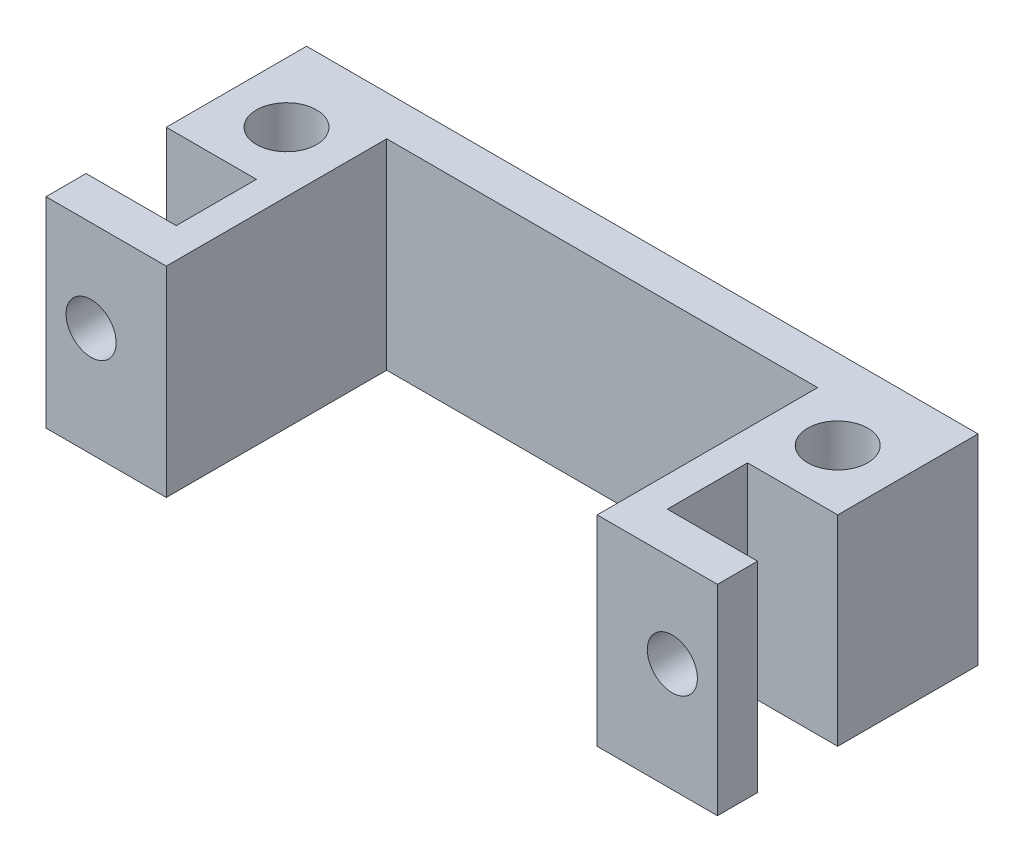
from build123d import *

# Parameters (mm, degrees)
BOSS_EXTRUDE1_DEPTH             = 25.4
SKETCH2_R                       = 3.81
CUT_EXTRUDE1_DEPTH              = 95.74063806
F_1_4_0_25_DIAMETER_HOLE1_D     = 6.35
F_1_4_0_25_DIAMETER_HOLE1_DEPTH = 7.62
F_1_4_0_25_DIAMETER_HOLE1_TIP   = 1.907732465
F_1_4_0_25_DIAMETER_HOLE2_D     = 6.35
F_1_4_0_25_DIAMETER_HOLE2_DEPTH = 10.16
F_1_4_0_25_DIAMETER_HOLE2_TIP   = 1.907732465


with BuildPart() as part:
    # Sketch1 → Boss-Extrude1 (new body)
    with BuildSketch(Plane(origin=(0, 0, 0), x_dir=(1, 0, 0), z_dir=(0, 1, 0))):
        Polygon((69.85, 0), (85.09, 0), (85.09, 5.08), (73.66, 5.08), (73.66, 15.24), (85.09, 15.24), (85.09, 33.02), (0, 33.02), (0, 15.24), (11.43, 15.24), (11.43, 5.08), (0, 5.08), (0, 0), (15.24, 0), (15.24, 27.94), (69.85, 27.94), align=None)
    extrude(amount=BOSS_EXTRUDE1_DEPTH)

    # Sketch2 → Cut-Extrude1 (cut, through all)
    with BuildSketch(Plane(origin=(0, 25.4, 0), x_dir=(1, 0, 0), z_dir=(0, 1, 0))):
        with Locations(Location((7.62, 22.86, 0), (0, 0, 270))):
            Circle(SKETCH2_R)
        with Locations(Location((77.47, 22.86, 0), (0, 0, 270))):
            Circle(SKETCH2_R)
    extrude(amount=-CUT_EXTRUDE1_DEPTH, mode=Mode.SUBTRACT)

    # 1/4 (0.25) Diameter Hole1
    with Locations(Plane.XY):
        with Locations((5.715, 13.802822473), (79.375, 13.802822473)):
            Hole(F_1_4_0_25_DIAMETER_HOLE1_D / 2, depth=F_1_4_0_25_DIAMETER_HOLE1_DEPTH)
            with Locations((0, 0, -(F_1_4_0_25_DIAMETER_HOLE1_DEPTH + F_1_4_0_25_DIAMETER_HOLE1_TIP / 2))):  # 118° drill point
                Cone(0, F_1_4_0_25_DIAMETER_HOLE1_D / 2, F_1_4_0_25_DIAMETER_HOLE1_TIP, mode=Mode.SUBTRACT)

    # 1/4 (0.25) Diameter Hole2
    with Locations(Plane(origin=(0, 0, -33.02), x_dir=(-1, 0, 0), z_dir=(0, 0, -1))):
        with Locations((-77.47, 12.7), (-7.62, 12.7)):
            Hole(F_1_4_0_25_DIAMETER_HOLE2_D / 2, depth=F_1_4_0_25_DIAMETER_HOLE2_DEPTH)
            with Locations((0, 0, -(F_1_4_0_25_DIAMETER_HOLE2_DEPTH + F_1_4_0_25_DIAMETER_HOLE2_TIP / 2))):  # 118° drill point
                Cone(0, F_1_4_0_25_DIAMETER_HOLE2_D / 2, F_1_4_0_25_DIAMETER_HOLE2_TIP, mode=Mode.SUBTRACT)


solid = part.part
